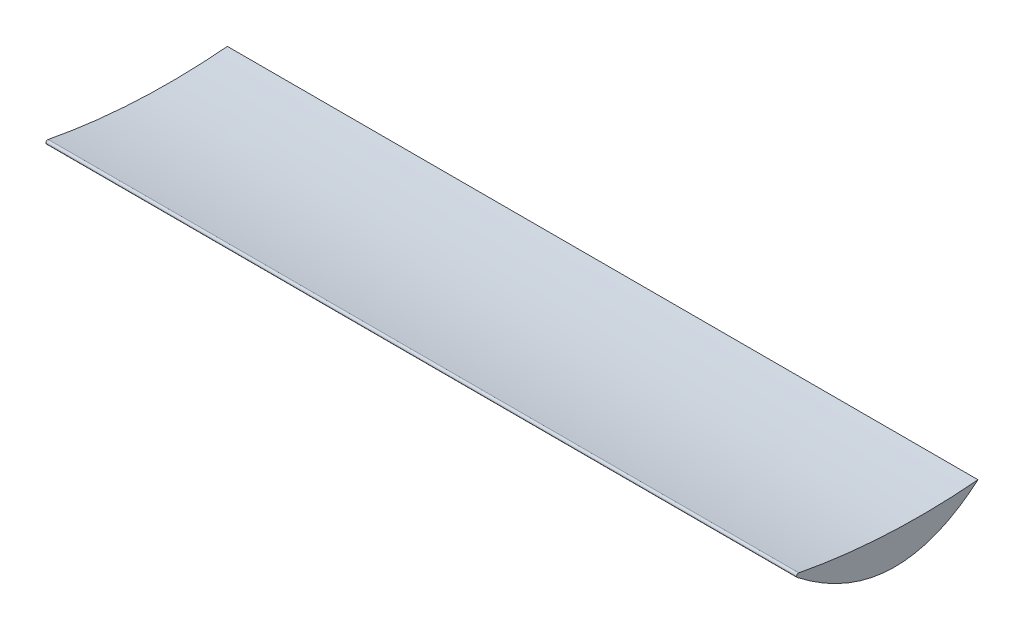
from build123d import *

# Parameters (mm, degrees)
BOSS_EXTRUDE1_DEPTH = 1016
FILLET1_R           = 2.54


with BuildPart() as part:
    # Sketch1 → Boss-Extrude1 (new body)
    with BuildSketch(Plane(origin=(0, 0, 0), x_dir=(0, 0, -1), z_dir=(1, 0, 0))):
        with BuildLine():
            add(Edge.make_bspline(
                [(-120.531229907, 22.77432195), (4.490783964, -2.671822575), (132.182362196, 8.624439203)],
                knots=[0, 0, 0, 1, 1, 1], degree=2))
            add(Edge.make_bspline(
                [(132.182362196, 8.624439203), (17.098761409, -89.807220092), (-120.531229907, 22.77432195)],
                knots=[0, 0, 0, 1, 1, 1], degree=2))
        make_face()
    extrude(amount=BOSS_EXTRUDE1_DEPTH)

    # Fillet1
    fillet1_edges = [part.edges().sort_by_distance(p)[0] for p in [
        (508, 22.77432195, 120.531229907),
    ]]
    fillet(fillet1_edges, radius=FILLET1_R)


solid = part.part
